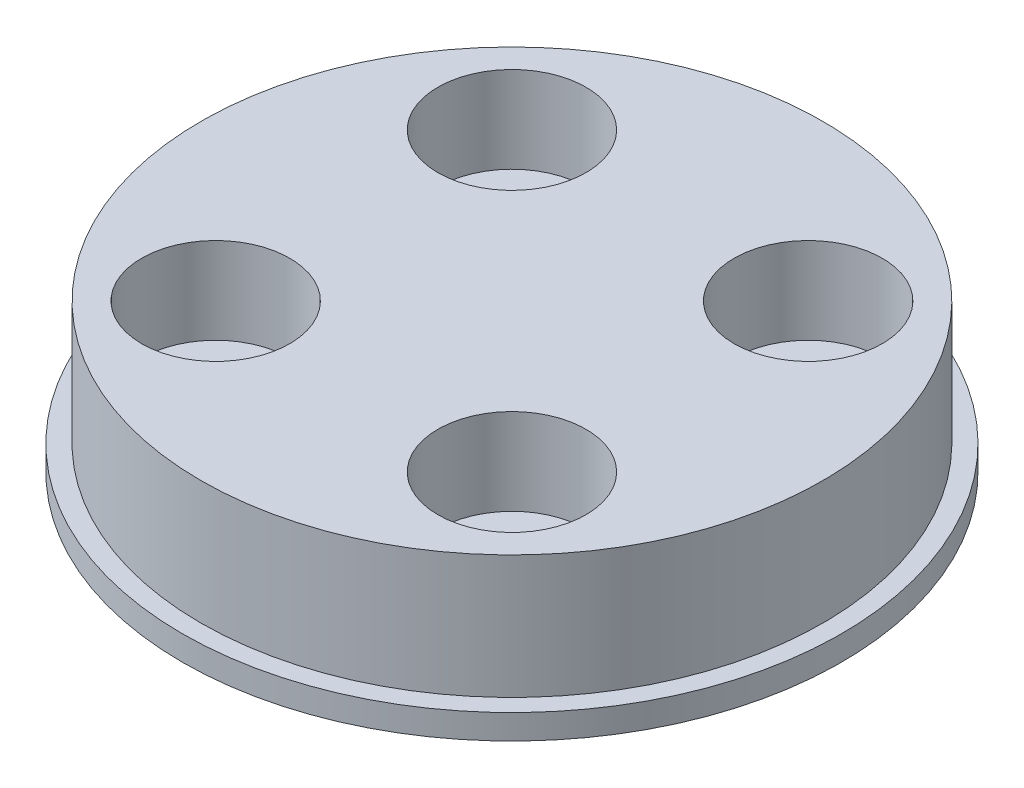
from build123d import *

# Parameters (mm, degrees)
SKETCH1_R           = 13.35
SKETCH1_R_2         = 12.6
SKETCH1_R_3         = 1.575
BOSS_EXTRUDE1_DEPTH = 1
SKETCH1_3_R         = 12.6
SKETCH1_3_R_2       = 1.575
BOSS_EXTRUDE2_DEPTH = 6
SKETCH2_R           = 3
CUT_EXTRUDE1_DEPTH  = 3.5


with BuildPart() as part:
    # Sketch1 → Boss-Extrude1 (new body)
    # profile 1 of 2: a face of its own
    with BuildSketch(Plane(origin=(0, 33, 0), x_dir=(1, 0, 0), z_dir=(0, 1, 0))):
        with Locations(Location((0, 0, 0), (0, 0, 270))):
            Circle(SKETCH1_R)
        Circle(SKETCH1_R_2, mode=Mode.SUBTRACT)
    # profile 2 of 2: a face of its own
    with BuildSketch(Plane(origin=(0, 33, 0), x_dir=(1, 0, 0), z_dir=(0, 1, 0))):
        Circle(SKETCH1_R_2)
        with Locations(Location((6, -6, 0), (0, 0, 270))):
            Circle(SKETCH1_R_3, mode=Mode.SUBTRACT)
        with Locations(Location((-6, 6, 0), (0, 0, 270))):
            Circle(SKETCH1_R_3, mode=Mode.SUBTRACT)
        with Locations(Location((6, 6, 0), (0, 0, 270))):
            Circle(SKETCH1_R_3, mode=Mode.SUBTRACT)
        with Locations(Location((-6, -6, 0), (0, 0, 270))):
            Circle(SKETCH1_R_3, mode=Mode.SUBTRACT)
    extrude(amount=BOSS_EXTRUDE1_DEPTH)

    # Sketch1<3> → Boss-Extrude2 (add)
    with BuildSketch(Plane(origin=(0, 33, 0), x_dir=(1, 0, 0), z_dir=(0, 1, 0))):
        with Locations(Location((0, 0, 0), (0, 0, 270))):
            Circle(SKETCH1_3_R)
        with Locations(Location((6, -6, 0), (0, 0, 270))):
            Circle(SKETCH1_3_R_2, mode=Mode.SUBTRACT)
        with Locations(Location((-6, 6, 0), (0, 0, 270))):
            Circle(SKETCH1_3_R_2, mode=Mode.SUBTRACT)
        with Locations(Location((6, 6, 0), (0, 0, 270))):
            Circle(SKETCH1_3_R_2, mode=Mode.SUBTRACT)
        with Locations(Location((-6, -6, 0), (0, 0, 270))):
            Circle(SKETCH1_3_R_2, mode=Mode.SUBTRACT)
    extrude(amount=BOSS_EXTRUDE2_DEPTH)

    # Sketch2 → Cut-Extrude1 (cut)
    with BuildSketch(Plane(origin=(0, 39, 0), x_dir=(1, 0, 0), z_dir=(0, 1, 0))):
        with Locations(Location((-6, 6, 0), (0, 0, 270))):
            Circle(SKETCH2_R)
        with Locations(Location((6, 6, 0), (0, 0, 270))):
            Circle(SKETCH2_R)
        with Locations(Location((6, -6, 0), (0, 0, 270))):
            Circle(SKETCH2_R)
        with Locations(Location((-6, -6, 0), (0, 0, 270))):
            Circle(SKETCH2_R)
    extrude(amount=-CUT_EXTRUDE1_DEPTH, mode=Mode.SUBTRACT)


solid = part.part
